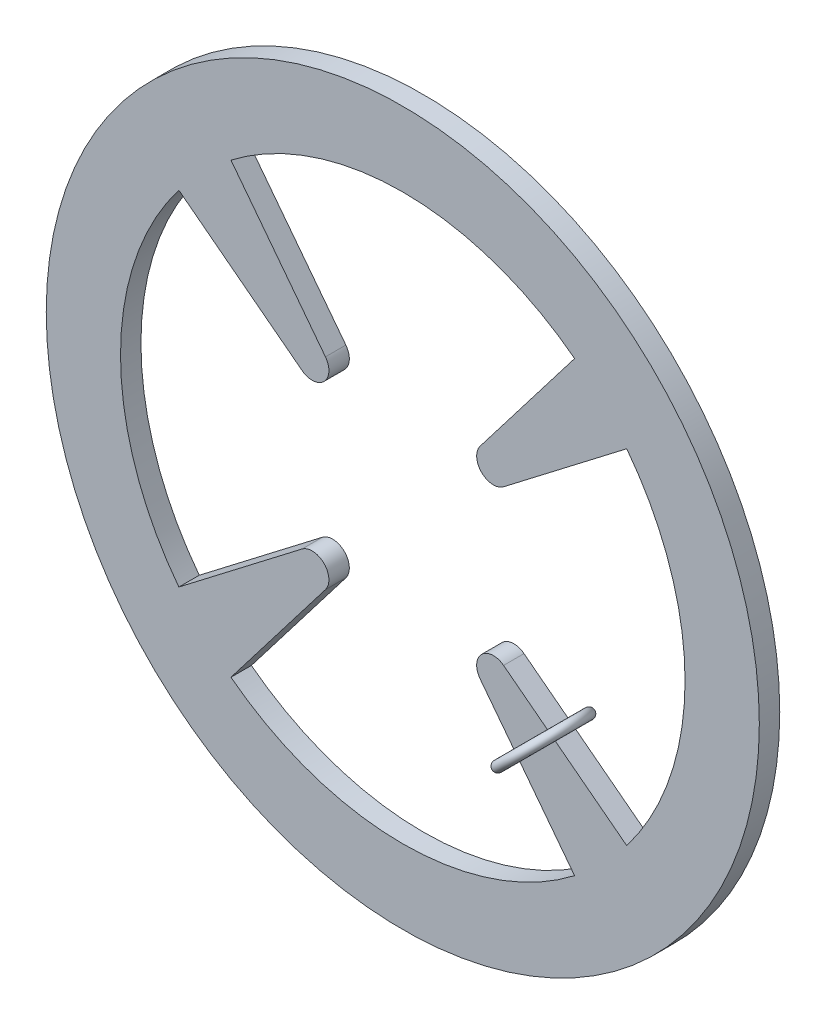
from build123d import *

# Parameters (mm, degrees)
SKETCH_1_R      = 0.96
SKETCH_1_R_2    = 0.76
EXTRUDE_1_DEPTH = 0.055
EXTRUDE_START   = -0.055
EXTRUDE_2_DEPTH = 0.055
SKETCH_73_R     = 0.0132


with BuildPart() as part:
    # 草圖1 → 填料-伸長1 (new body)
    with BuildSketch(Plane.XY):
        Circle(SKETCH_1_R)
        Circle(SKETCH_1_R_2, mode=Mode.SUBTRACT)
    extrude(amount=EXTRUDE_1_DEPTH)

    # 草圖2 → 填料-伸長2 (add)
    with BuildSketch(Plane.XY.offset(0.055).offset(EXTRUDE_START)):
        with BuildLine():
            Line((-0.208247811, 0.271393831), (-0.462658686, 0.602948539))
            ThreePointArc((-0.462658686, 0.602948539), (-0.537401154, 0.537401154), (-0.602948539, 0.462658686))
            Line((-0.602948539, 0.462658686), (-0.271393831, 0.208247811))
            ThreePointArc((-0.271393831, 0.208247811), (-0.241031974, 0.199037642), (-0.212132034, 0.212132034))
            ThreePointArc((-0.212132034, 0.212132034), (-0.199037642, 0.241031974), (-0.208247811, 0.271393831))
        make_face()
        with BuildLine():
            ThreePointArc((0.208247811, 0.271393831), (0.199037642, 0.241031974), (0.212132034, 0.212132034))
            ThreePointArc((0.212132034, 0.212132034), (0.241031974, 0.199037642), (0.271393831, 0.208247811))
            Line((0.271393831, 0.208247811), (0.602948539, 0.462658686))
            ThreePointArc((0.602948539, 0.462658686), (0.537401154, 0.537401154), (0.462658686, 0.602948539))
            Line((0.462658686, 0.602948539), (0.208247811, 0.271393831))
        make_face()
        with BuildLine():
            ThreePointArc((0.271393831, -0.208247811), (0.241031974, -0.199037642), (0.212132034, -0.212132034))
            ThreePointArc((0.212132034, -0.212132034), (0.199037642, -0.241031974), (0.208247811, -0.271393831))
            Line((0.208247811, -0.271393831), (0.462658686, -0.602948539))
            ThreePointArc((0.462658686, -0.602948539), (0.537401154, -0.537401154), (0.602948539, -0.462658686))
            Line((0.602948539, -0.462658686), (0.271393831, -0.208247811))
        make_face()
        with BuildLine():
            ThreePointArc((-0.208247811, -0.271393831), (-0.199037642, -0.241031974), (-0.212132034, -0.212132034))
            ThreePointArc((-0.212132034, -0.212132034), (-0.241031974, -0.199037642), (-0.271393831, -0.208247811))
            Line((-0.271393831, -0.208247811), (-0.602948539, -0.462658686))
            ThreePointArc((-0.602948539, -0.462658686), (-0.537401154, -0.537401154), (-0.462658686, -0.602948539))
            Line((-0.462658686, -0.602948539), (-0.208247811, -0.271393831))
        make_face()
    extrude(amount=EXTRUDE_2_DEPTH)


with BuildPart() as body_2:
    # 掃出2: sweep along a path in 草圖72
    with BuildLine(Plane(origin=(0.353553391, -0.353553391, 0), x_dir=(0, 0, -1), z_dir=(0.7071067811865487, -0.7071067811865464, 0))) as sweep_2_path:
        CenterArc((-0.03, 0), 0.1, 0, 360)
    # 草圖73 → 掃出2 (sweep)
    with BuildSketch(Plane(origin=(0.424264069, -0.282842712, 0.03), x_dir=(1, 0, 0), z_dir=(0, 0, 1))):
        Circle(SKETCH_73_R)
    sweep(path=sweep_2_path.line)


solid = Compound([part.part, body_2.part])
